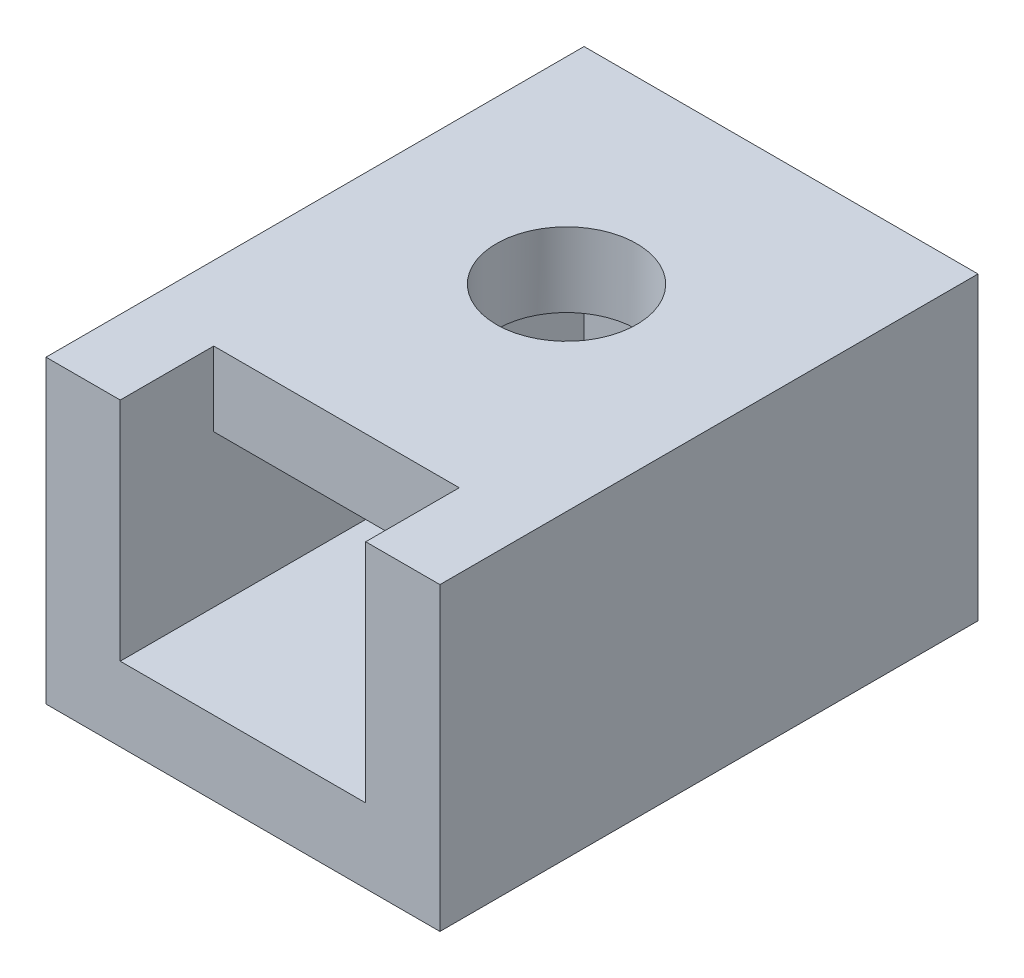
from build123d import *

# Parameters (mm, degrees)
SKETCH1_W           = 10.5
SKETCH1_H           = 6.5
BOSS_EXTRUDE1_DEPTH = 19.84
SHELL1_T            = 3.175
CUT_EXTRUDE1_REACH  = 27.094
SKETCH2_R           = 3
SKETCH2_W           = 10.5
SKETCH2_H           = 4


with BuildPart() as part:
    # Sketch1 → Boss-Extrude1 (new body)
    with BuildSketch(Plane.XY):
        Rectangle(SKETCH1_W, SKETCH1_H)
    extrude(amount=BOSS_EXTRUDE1_DEPTH)

    # Shell1
    shell1_openings = [part.faces().sort_by_distance(p)[0] for p in [
        (0, 0, 19.84),
    ]]
    offset(amount=SHELL1_T, openings=shell1_openings, kind=Kind.INTERSECTION)

    # Sketch2 → Cut-Extrude1 (cut, up to next)
    with BuildSketch(Plane(origin=(0, 6.425, 0), x_dir=(1, 0, 0), z_dir=(0, 1, 0)), mode=Mode.PRIVATE) as cut_extrude1_sk1:
        with Locations(Location((0, -6, 0), (0, 0, 270))):
            Circle(SKETCH2_R)
    cut_extrude1_tool1 = extrude(cut_extrude1_sk1.sketch, amount=-CUT_EXTRUDE1_REACH, mode=Mode.PRIVATE) & part.part
    # Sketch2 → Cut-Extrude1 (cut, up to next)
    with BuildSketch(Plane(origin=(0, 6.425, 0), x_dir=(1, 0, 0), z_dir=(0, 1, 0)), mode=Mode.PRIVATE) as cut_extrude1_sk2:
        with Locations((0, -17.84)):
            Rectangle(SKETCH2_W, SKETCH2_H)
    cut_extrude1_tool2 = extrude(cut_extrude1_sk2.sketch, amount=-CUT_EXTRUDE1_REACH, mode=Mode.PRIVATE) & part.part
    add(cut_extrude1_tool1.solids().sort_by_distance((0, 6.425, 6))[0], mode=Mode.SUBTRACT)
    add(cut_extrude1_tool2.solids().sort_by_distance((0, 6.425, 17.84))[0], mode=Mode.SUBTRACT)


solid = part.part
